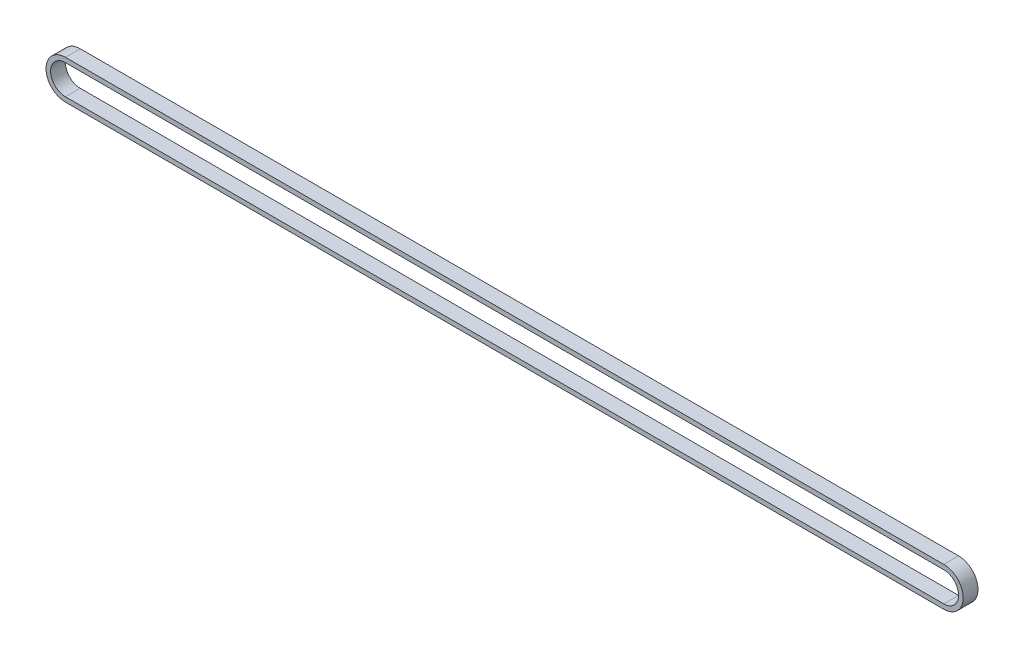
from build123d import *

# Parameters (mm, degrees)
BOSS_EXTRUDE1_DEPTH = 8


with BuildPart() as part:
    # Sketch1 → Boss-Extrude1 (new, symmetric)
    with BuildSketch(Plane.XY):
        with BuildLine():
            Line((0, 21), (950, 21))
            ThreePointArc((950, 21), (971, 0), (950, -21))
            Line((950, -21), (0, -21))
            ThreePointArc((0, -21), (-21, 0), (0, 21))
        make_face()
        with BuildLine():
            Line((0, 16), (950, 16))
            ThreePointArc((950, 16), (966, 0), (950, -16))
            Line((950, -16), (0, -16))
            ThreePointArc((0, -16), (-16, 0), (0, 16))
        make_face(mode=Mode.SUBTRACT)
    extrude(amount=BOSS_EXTRUDE1_DEPTH, both=True)


solid = part.part
